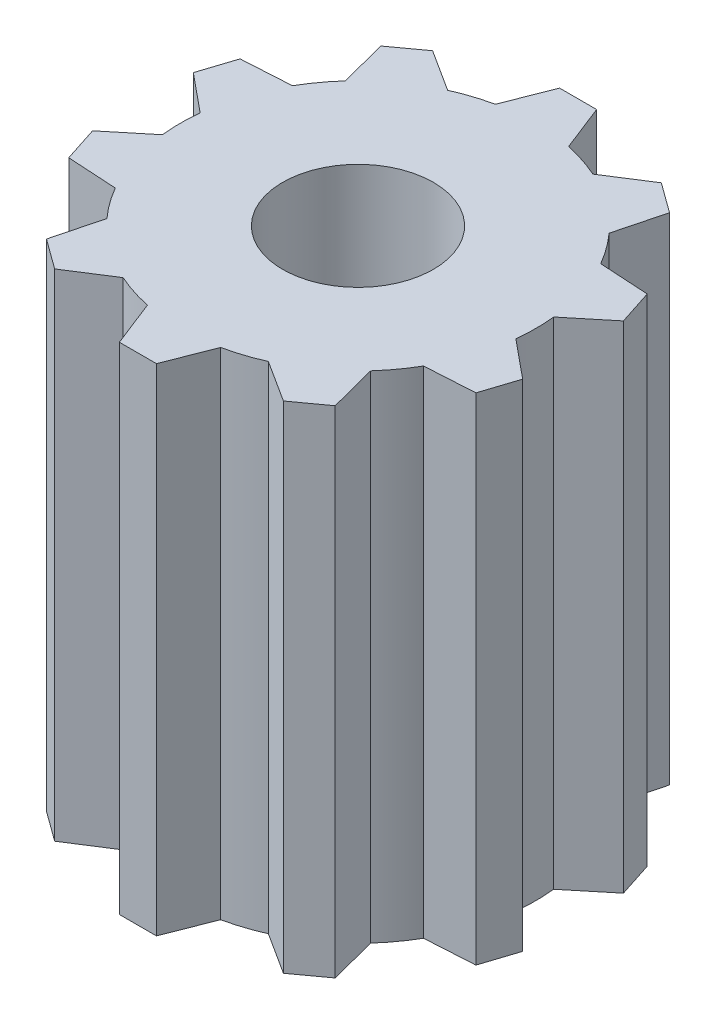
from build123d import *

# Parameters (mm, degrees)
SKETCH1_R            = 3.5
BOSS_EXTRUDE1_DEPTH  = 5
SKETCH12_R           = 8.25
SKETCH12_R_2         = 3.5
BOSS_EXTRUDE6_DEPTH  = 5
BOSS_EXTRUDE9_DEPTH  = 5
CIRPATTERN2_COUNT    = 10
CUT_EXTRUDE1_START   = -10
SKETCH14_R           = 3.5
CUT_EXTRUDE1_DEPTH   = 10
SKETCH17_R           = 8.25
SKETCH17_R_2         = 3.5
BOSS_EXTRUDE10_DEPTH = 18


with BuildPart() as part:
    # Sketch1 → Boss-Extrude1 (new body)
    with BuildSketch(Plane(origin=(0, 0, 0), x_dir=(1, 0, 0), z_dir=(0, 1, 0))):
        with Locations(Location((0, 0, 0), (0, 0, 270))):
            Circle(SKETCH1_R)
    extrude(amount=BOSS_EXTRUDE1_DEPTH)

    # Sketch14 → Cut-Extrude1 (cut)
    with BuildSketch(Plane(origin=(0, 5, 0), x_dir=(1, 0, 0), z_dir=(0, 1, 0)).offset(CUT_EXTRUDE1_START)):
        with Locations(Location((0, 0, 0), (0, 0, 90))):
            Circle(SKETCH14_R)
    extrude(amount=CUT_EXTRUDE1_DEPTH, mode=Mode.SUBTRACT)


with BuildPart() as body_2:
    # Sketch12 → Boss-Extrude6 (new body)
    with BuildSketch(Plane(origin=(0, 5, 0), x_dir=(-1, 0, 0), z_dir=(0, -1, 0))):
        with Locations(Location((0, 0, 0), (0, 0, 90))):
            Circle(SKETCH12_R)
        with Locations(Location((0, 0, 0), (0, 0, 90))):
            Circle(SKETCH12_R_2, mode=Mode.SUBTRACT)
    extrude(amount=BOSS_EXTRUDE6_DEPTH)



with BuildPart() as body_3:
    # Sketch13 → Boss-Extrude9 (new body)
    with BuildSketch(Plane.XZ):
        with BuildLine():
            Line((1.7, 8.072948656), (0.86, 10.213858233))
            Line((0.86, 10.213858233), (-0.86, 10.213858233))
            Line((-0.86, 10.213858233), (-1.7, 8.072948656))
            ThreePointArc((-1.7, 8.072948656), (0, 8.25), (1.7, 8.072948656))
        make_face()
    extrude(amount=-BOSS_EXTRUDE9_DEPTH)


with BuildPart() as cirpattern2_1:
    # CirPattern2: pattern copy
    add(body_3.part.rotate(Axis((0, 0, 0), (0, 1, 0)), 1 * 360 / CIRPATTERN2_COUNT))


with BuildPart() as cirpattern2_2:
    # CirPattern2: pattern copy
    add(body_3.part.rotate(Axis((0, 0, 0), (0, 1, 0)), 2 * 360 / CIRPATTERN2_COUNT))


with BuildPart() as cirpattern2_3:
    # CirPattern2: pattern copy
    add(body_3.part.rotate(Axis((0, 0, 0), (0, 1, 0)), 3 * 360 / CIRPATTERN2_COUNT))


with BuildPart() as cirpattern2_4:
    # CirPattern2: pattern copy
    add(body_3.part.rotate(Axis((0, 0, 0), (0, 1, 0)), 4 * 360 / CIRPATTERN2_COUNT))


with BuildPart() as cirpattern2_5:
    # CirPattern2: pattern copy
    add(body_3.part.rotate(Axis((0, 0, 0), (0, 1, 0)), 5 * 360 / CIRPATTERN2_COUNT))


with BuildPart() as cirpattern2_6:
    # CirPattern2: pattern copy
    add(body_3.part.rotate(Axis((0, 0, 0), (0, 1, 0)), 6 * 360 / CIRPATTERN2_COUNT))


with BuildPart() as cirpattern2_7:
    # CirPattern2: pattern copy
    add(body_3.part.rotate(Axis((0, 0, 0), (0, 1, 0)), 7 * 360 / CIRPATTERN2_COUNT))


with BuildPart() as cirpattern2_8:
    # CirPattern2: pattern copy
    add(body_3.part.rotate(Axis((0, 0, 0), (0, 1, 0)), 8 * 360 / CIRPATTERN2_COUNT))


with BuildPart() as cirpattern2_9:
    # CirPattern2: pattern copy
    add(body_3.part.rotate(Axis((0, 0, 0), (0, 1, 0)), 9 * 360 / CIRPATTERN2_COUNT))


with BuildPart() as body_2_1:
    add(body_2.part)

    add(body_3.part)  # Boss-Extrude10 merges body 3

    add(cirpattern2_1.part)  # Boss-Extrude10 merges CirPattern2_1

    add(cirpattern2_2.part)  # Boss-Extrude10 merges CirPattern2_2

    add(cirpattern2_3.part)  # Boss-Extrude10 merges CirPattern2_3

    add(cirpattern2_4.part)  # Boss-Extrude10 merges CirPattern2_4

    add(cirpattern2_5.part)  # Boss-Extrude10 merges CirPattern2_5

    add(cirpattern2_6.part)  # Boss-Extrude10 merges CirPattern2_6

    add(cirpattern2_7.part)  # Boss-Extrude10 merges CirPattern2_7

    add(cirpattern2_8.part)  # Boss-Extrude10 merges CirPattern2_8

    add(cirpattern2_9.part)  # Boss-Extrude10 merges CirPattern2_9
    # Sketch17 → Boss-Extrude10 (add)
    # profile 1 of 11: a face of its own
    with BuildSketch(Plane.XZ):
        Circle(SKETCH17_R)
        with Locations(Location((0, 0, 0), (0, 0, 270))):
            Circle(SKETCH17_R_2, mode=Mode.SUBTRACT)
    # profile 2 of 11: a face of its own
    with BuildSketch(Plane.XZ):
        with BuildLine():
            ThreePointArc((-1.7, 8.072948656), (0, 8.25), (1.7, 8.072948656))
            Line((1.7, 8.072948656), (0.86, 10.213858233))
            Line((0.86, 10.213858233), (-0.86, 10.213858233))
            Line((-0.86, 10.213858233), (-1.7, 8.072948656))
        make_face()
    # profile 3 of 11: a face of its own
    with BuildSketch(Plane.XZ):
        with BuildLine():
            ThreePointArc((-6.120489053, 5.531917728), (-4.849228331, 6.674390204), (-3.369831272, 7.530387586))
            Line((-3.369831272, 7.530387586), (-5.307800623, 8.768680205))
            Line((-5.307800623, 8.768680205), (-6.699309853, 7.757689572))
            Line((-6.699309853, 7.757689572), (-6.120489053, 5.531917728))
        make_face()
    # profile 4 of 11: a face of its own
    with BuildSketch(Plane.XZ):
        with BuildLine():
            Line((-9.979711044, 2.338347168), (-8.203159315, 0.877882252))
            ThreePointArc((-8.203159315, 0.877882252), (-7.846216259, 2.549390204), (-7.152501534, 4.111474407))
            Line((-7.152501534, 4.111474407), (-9.448201814, 3.974164376))
            Line((-9.448201814, 3.974164376), (-9.979711044, 2.338347168))
        make_face()
    # profile 5 of 11: a face of its own
    with BuildSketch(Plane.XZ):
        with BuildLine():
            Line((-9.448201814, -3.974164376), (-7.152501534, -4.111474407))
            ThreePointArc((-7.152501534, -4.111474407), (-7.846216259, -2.549390204), (-8.203159315, -0.877882252))
            Line((-8.203159315, -0.877882252), (-9.979711044, -2.338347168))
            Line((-9.979711044, -2.338347168), (-9.448201814, -3.974164376))
        make_face()
    # profile 6 of 11: a face of its own
    with BuildSketch(Plane.XZ):
        with BuildLine():
            Line((-5.307800623, -8.768680205), (-3.369831272, -7.530387586))
            ThreePointArc((-3.369831272, -7.530387586), (-4.849228331, -6.674390204), (-6.120489053, -5.531917728))
            Line((-6.120489053, -5.531917728), (-6.699309853, -7.757689572))
            Line((-6.699309853, -7.757689572), (-5.307800623, -8.768680205))
        make_face()
    # profile 7 of 11: a face of its own
    with BuildSketch(Plane.XZ):
        with BuildLine():
            Line((0.86, -10.213858233), (1.7, -8.072948656))
            ThreePointArc((1.7, -8.072948656), (0, -8.25), (-1.7, -8.072948656))
            Line((-1.7, -8.072948656), (-0.86, -10.213858233))
            Line((-0.86, -10.213858233), (0.86, -10.213858233))
        make_face()
    # profile 8 of 11: a face of its own
    with BuildSketch(Plane.XZ):
        with BuildLine():
            Line((6.699309853, -7.757689572), (6.120489053, -5.531917728))
            ThreePointArc((6.120489053, -5.531917728), (4.849228331, -6.674390204), (3.369831272, -7.530387586))
            Line((3.369831272, -7.530387586), (5.307800623, -8.768680205))
            Line((5.307800623, -8.768680205), (6.699309853, -7.757689572))
        make_face()
    # profile 9 of 11: a face of its own
    with BuildSketch(Plane.XZ):
        with BuildLine():
            Line((7.152501534, -4.111474407), (9.448201814, -3.974164376))
            Line((9.448201814, -3.974164376), (9.979711044, -2.338347168))
            Line((9.979711044, -2.338347168), (8.203159315, -0.877882252))
            ThreePointArc((8.203159315, -0.877882252), (7.846216259, -2.549390204), (7.152501534, -4.111474407))
        make_face()
    # profile 10 of 11: a face of its own
    with BuildSketch(Plane.XZ):
        with BuildLine():
            ThreePointArc((7.152501534, 4.111474407), (7.846216259, 2.549390204), (8.203159315, 0.877882252))
            Line((8.203159315, 0.877882252), (9.979711044, 2.338347168))
            Line((9.979711044, 2.338347168), (9.448201814, 3.974164376))
            Line((9.448201814, 3.974164376), (7.152501534, 4.111474407))
        make_face()
    # profile 11 of 11: a face of its own
    with BuildSketch(Plane.XZ):
        with BuildLine():
            ThreePointArc((3.369831272, 7.530387586), (4.849228331, 6.674390204), (6.120489053, 5.531917728))
            Line((6.120489053, 5.531917728), (6.699309853, 7.757689572))
            Line((6.699309853, 7.757689572), (5.307800623, 8.768680205))
            Line((5.307800623, 8.768680205), (3.369831272, 7.530387586))
        make_face()
    extrude(amount=BOSS_EXTRUDE10_DEPTH)


solid = body_2_1.part
